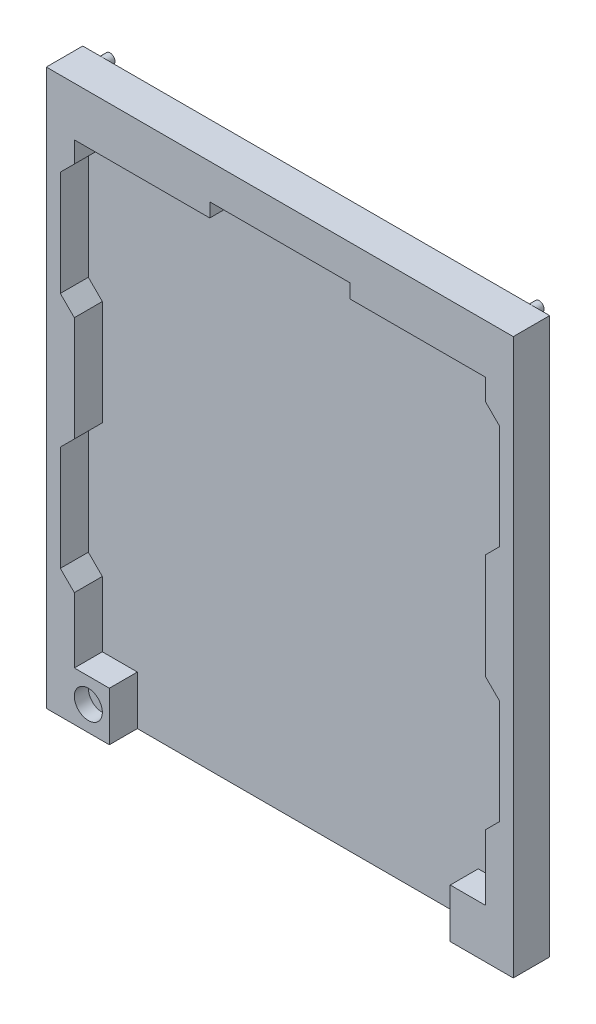
from build123d import *

# Parameters (mm, degrees)
ESQUISSE1_W             = 33.34
ESQUISSE1_H             = 39.66
BOSS_EXTRU_1_DEPTH      = 0.6
BOSS_EXTRU_2_DEPTH      = 2
ESQUISSE3_R             = 0.35
BOSS_EXTRU_3_DEPTH      = 0.6
ESQUISSE4_R             = 1
ENL_V_MAT_EXTRU_1_DEPTH = 1


with BuildPart() as part:
    # Esquisse1 → Boss.-Extru.1 (new body)
    with BuildSketch(Plane.XY):
        with Locations((-16.67, 19.83)):
            Rectangle(ESQUISSE1_W, ESQUISSE1_H)
    extrude(amount=BOSS_EXTRU_1_DEPTH)

    # Esquisse2 → Boss.-Extru.2 (add)
    with BuildSketch(Plane.XY.offset(0.6)):
        Polygon((-31.34, 34.66), (-31.34, 36.16), (-21.67, 36.16), (-21.67, 37.16), (-11.67, 37.16), (-11.67, 36.16), (-2, 36.16), (-2, 34.66), (-1, 33.66), (-1, 26.16), (-2, 25.16), (-2, 17.66), (-1, 16.66), (-1, 9.16), (-2, 8.16), (-2, 3.5), (-4.5, 3.5), (-4.5, 0), (0, 0), (0, 39.66), (-33.34, 39.66), (-33.34, 0), (-28.84, 0), (-28.84, 3.5), (-31.34, 3.5), (-31.34, 8.16), (-32.34, 9.16), (-32.34, 16.66), (-31.34, 17.66), (-31.34, 25.16), (-32.34, 26.16), (-32.34, 33.66), align=None)
    extrude(amount=BOSS_EXTRU_2_DEPTH)

    # Esquisse3 → Boss.-Extru.3 (add)
    with BuildSketch(Plane(origin=(0, 0, 0), x_dir=(-1, 0, 0), z_dir=(0, 0, -1))):
        with Locations(Location((1.35, 39.26, 0), (0, 0, 180))):
            Circle(ESQUISSE3_R)
        with Locations(Location((31.99, 39.26, 0), (0, 0, 180))):
            Circle(ESQUISSE3_R)
    extrude(amount=BOSS_EXTRU_3_DEPTH)

    # Esquisse4 → Enlèv. mat.-Extru.1 (cut)
    with BuildSketch(Plane.XY.offset(2.6)):
        with Locations((-30.34, 1.75)):
            Circle(ESQUISSE4_R)
    extrude(amount=-ENL_V_MAT_EXTRU_1_DEPTH, mode=Mode.SUBTRACT)


solid = part.part
